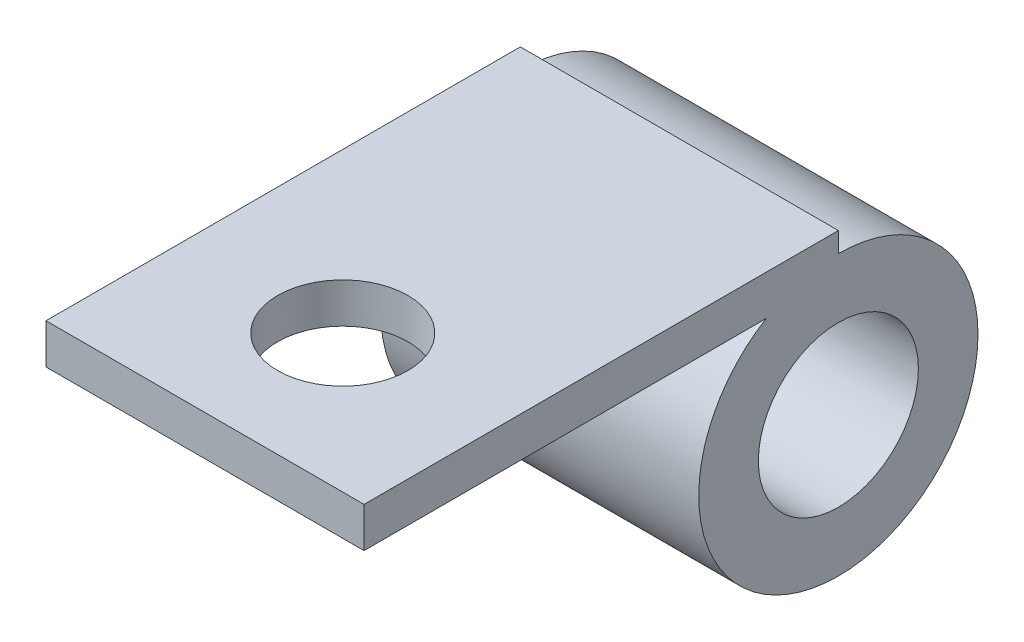
from build123d import *

# Parameters (mm, degrees)
LOOP_SKETCH_R       = 5.575
LOOP_DEPTH          = 6.35
TAB_SKETCH_W        = 18.94
TAB_SKETCH_H        = 1.6
TAB_DEPTH           = 6.35
TUBE_HOLE_SKETCH_R  = 3.195
TUBE_HOLE_DEPTH     = 7.35
MOUNT_HOLE_SKETCH_R = 2.6
MOUNT_HOLE_DEPTH    = 20


with BuildPart() as part:
    # Loop Sketch → Loop (new, symmetric)
    with BuildSketch(Plane(origin=(0, 0, 0), x_dir=(0, 0, -1), z_dir=(1, 0, 0))):
        Circle(LOOP_SKETCH_R)
    extrude(amount=LOOP_DEPTH, both=True)

    # Tab Sketch → Tab (add, symmetric)
    with BuildSketch(Plane(origin=(0, 0, 0), x_dir=(0, 0, -1), z_dir=(1, 0, 0))):
        with Locations((-9.47, 5.575)):
            Rectangle(TAB_SKETCH_W, TAB_SKETCH_H)
    extrude(amount=TAB_DEPTH, both=True)

    # Tube Hole Sketch → Tube Hole (cut, symmetric)
    with BuildSketch(Plane(origin=(0, 0, 0), x_dir=(0, 0, -1), z_dir=(1, 0, 0))):
        Circle(TUBE_HOLE_SKETCH_R)
    extrude(amount=TUBE_HOLE_DEPTH, both=True, mode=Mode.SUBTRACT)

    # Mount Hole Sketch → Mount Hole (cut, symmetric)
    with BuildSketch(Plane(origin=(0, 0, 0), x_dir=(1, 0, 0), z_dir=(0, 1, 0))):
        with Locations((0, -13.44)):
            Circle(MOUNT_HOLE_SKETCH_R)
    extrude(amount=MOUNT_HOLE_DEPTH, both=True, mode=Mode.SUBTRACT)


solid = part.part
